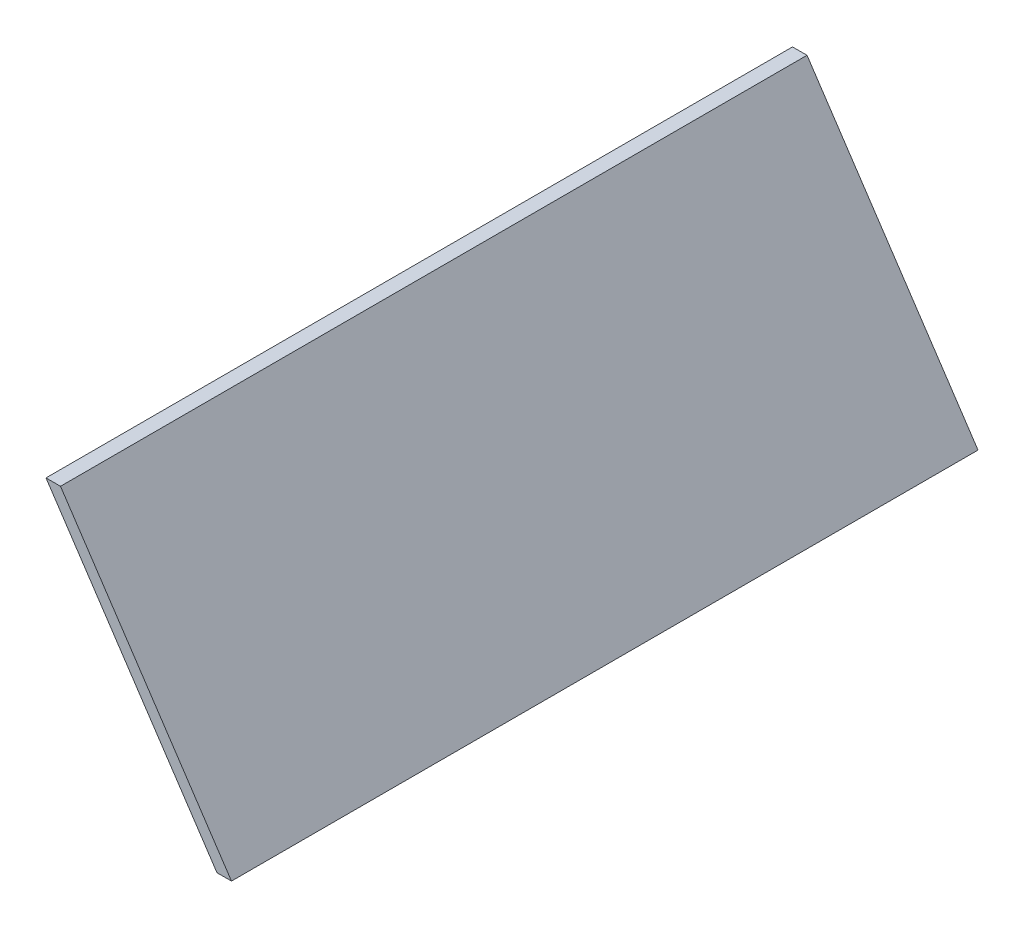
from build123d import *

# Parameters (mm, degrees)
BOSS_EXTRUDE1_DEPTH = 277.48


with BuildPart() as part:
    # Sketch1 → Boss-Extrude1 (new body)
    with BuildSketch(Plane.XY):
        Polygon((-194.892333822, -15.582627434), (-148.070819622, -85.815078074), (-142.680341112, -85.815078074), (-190.272105908, -14.42724859), (-206.228479267, 9.507372566), (-211.618957777, 9.507372566), align=None)
    extrude(amount=BOSS_EXTRUDE1_DEPTH)


solid = part.part
